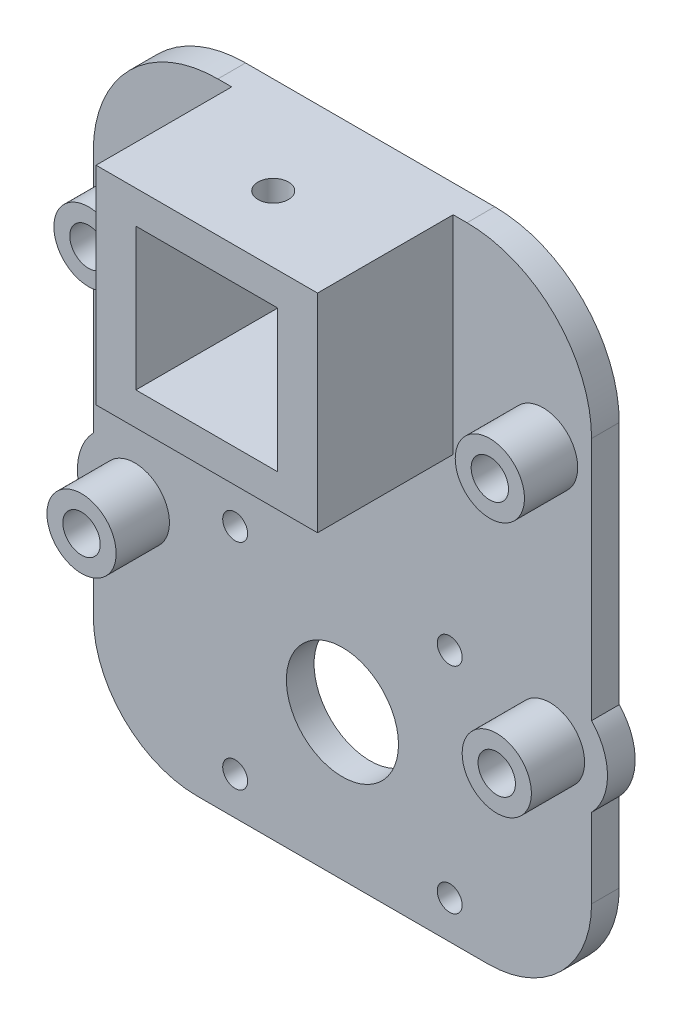
from build123d import *

# Parameters (mm, degrees)
SKETCH_1_R          = 1.8
SKETCH_1_R_2        = 8.1
SKETCH_1_R_3        = 2.7
SKETCH_1_W          = 20.5
SKETCH_1_H          = 20.5
EXTRUDE_1_DEPTH     = 4
EXTRUDE_START       = 4
SKETCH_1_4_W        = 32
SKETCH_1_4_H        = 30
SKETCH_1_4_W_2      = 20.5
SKETCH_1_4_H_2      = 20.5
SKETCH_1_4_R        = 1.6
EXTRUDE_3_DEPTH     = 19.6
CUT_EXTRUDE_4_REACH = 103.737
SKETCH_8_R          = 2.2
SKETCH_9_R          = 5
SKETCH_9_R_2        = 2.7
EXTRUDE_4_DEPTH     = 7.7


with BuildPart() as part:
    # 草图1 → 凸台-拉伸1 (new body)
    with BuildSketch(Plane.XY):
        with BuildLine():
            ThreePointArc((-36, -25.5), (-31.606601718, -36.106601718), (-21, -40.5))
            Line((-21, -40.5), (21, -40.5))
            ThreePointArc((21, -40.5), (31.606601718, -36.106601718), (36, -25.5))
            Line((36, -25.5), (36, -14.034980384))
            ThreePointArc((36, -14.034980384), (38.3, -8.3), (36, -2.565019616))
            Line((36, -2.565019616), (36, 32.75))
            ThreePointArc((36, 32.75), (30.727922061, 45.477922061), (18, 50.75))
            Line((18, 50.75), (-18, 50.75))
            ThreePointArc((-18, 50.75), (-30.727922061, 45.477922061), (-36, 32.75))
            Line((-36, 32.75), (-36, -2.565019616))
            ThreePointArc((-36, -2.565019616), (-38.3, -8.3), (-36, -14.034980384))
            Line((-36, -14.034980384), (-36, -25.5))
        make_face()
        with Locations((15.5, -35)):
            Circle(SKETCH_1_R, mode=Mode.SUBTRACT)
        with Locations((0, -19.5)):
            Circle(SKETCH_1_R_2, mode=Mode.SUBTRACT)
        with Locations((15.5, -4)):
            Circle(SKETCH_1_R, mode=Mode.SUBTRACT)
        with Locations((-15.5, -35)):
            Circle(SKETCH_1_R, mode=Mode.SUBTRACT)
        with Locations((-15.5, -4)):
            Circle(SKETCH_1_R, mode=Mode.SUBTRACT)
        with Locations((-30, -8.3)):
            Circle(SKETCH_1_R_3, mode=Mode.SUBTRACT)
        with Locations((30, -8.3)):
            Circle(SKETCH_1_R_3, mode=Mode.SUBTRACT)
        with Locations((-29, 28.1)):
            Circle(SKETCH_1_R_3, mode=Mode.SUBTRACT)
        with Locations((29, 28.1)):
            Circle(SKETCH_1_R_3, mode=Mode.SUBTRACT)
        with Locations((0, 35.75)):
            Rectangle(SKETCH_1_W, SKETCH_1_H, mode=Mode.SUBTRACT)
    extrude(amount=EXTRUDE_1_DEPTH)

    # 草图1<4> → 凸台-拉伸3 (add)
    # profile 1 of 3: a face of its own
    with BuildSketch(Plane.XY.offset(EXTRUDE_START)):
        with Locations((0, 35.75)):
            Rectangle(SKETCH_1_4_W, SKETCH_1_4_H)
        with Locations((0, 35.75)):
            Rectangle(SKETCH_1_4_W_2, SKETCH_1_4_H_2, mode=Mode.SUBTRACT)
    # profile 2 of 3: a face of its own
    with BuildSketch(Plane.XY.offset(EXTRUDE_START)):
        with Locations((-13.2, 35.75)):
            Circle(SKETCH_1_4_R)
    # profile 3 of 3: a face of its own
    with BuildSketch(Plane.XY.offset(EXTRUDE_START)):
        with Locations((13.2, 35.75)):
            Circle(SKETCH_1_4_R)
    extrude(amount=EXTRUDE_3_DEPTH)

    # 草图8 → 切除-拉伸4 (cut, up to next)
    with BuildSketch(Plane(origin=(0, 50.75, 0), x_dir=(1, 0, 0), z_dir=(0, 1, 0)), mode=Mode.PRIVATE) as cut_extrude_4_sk1:
        with Locations(Location((0, -14, 0), (0, 0, 270))):
            Circle(SKETCH_8_R)
    cut_extrude_4_tool1 = extrude(cut_extrude_4_sk1.sketch, amount=-CUT_EXTRUDE_4_REACH, mode=Mode.PRIVATE) & part.part
    add(cut_extrude_4_tool1.solids().sort_by_distance((0, 50.75, 14))[0], mode=Mode.SUBTRACT)

    # 草图9 → 凸台-拉伸4 (add)
    # profile 1 of 4: a face of its own
    with BuildSketch(Plane.XY.offset(4)):
        with Locations(Location((-29, 28.1, 0), (0, 0, 180))):
            Circle(SKETCH_9_R)
        with Locations((-29, 28.1)):
            Circle(SKETCH_9_R_2, mode=Mode.SUBTRACT)
    # profile 2 of 4: a face of its own
    with BuildSketch(Plane.XY.offset(4)):
        with Locations(Location((-30, -8.3, 0), (0, 0, 180))):
            Circle(SKETCH_9_R)
        with Locations((-30, -8.3)):
            Circle(SKETCH_9_R_2, mode=Mode.SUBTRACT)
    # profile 3 of 4: a face of its own
    with BuildSketch(Plane.XY.offset(4)):
        with Locations(Location((30, -8.3, 0), (0, 0, 180))):
            Circle(SKETCH_9_R)
        with Locations(Location((30, -8.3, 0), (0, 0, 180))):
            Circle(SKETCH_9_R_2, mode=Mode.SUBTRACT)
    # profile 4 of 4: a face of its own
    with BuildSketch(Plane.XY.offset(4)):
        with Locations(Location((29, 28.1, 0), (0, 0, 180))):
            Circle(SKETCH_9_R)
        with Locations(Location((29, 28.1, 0), (0, 0, 180))):
            Circle(SKETCH_9_R_2, mode=Mode.SUBTRACT)
    extrude(amount=EXTRUDE_4_DEPTH)


solid = part.part
